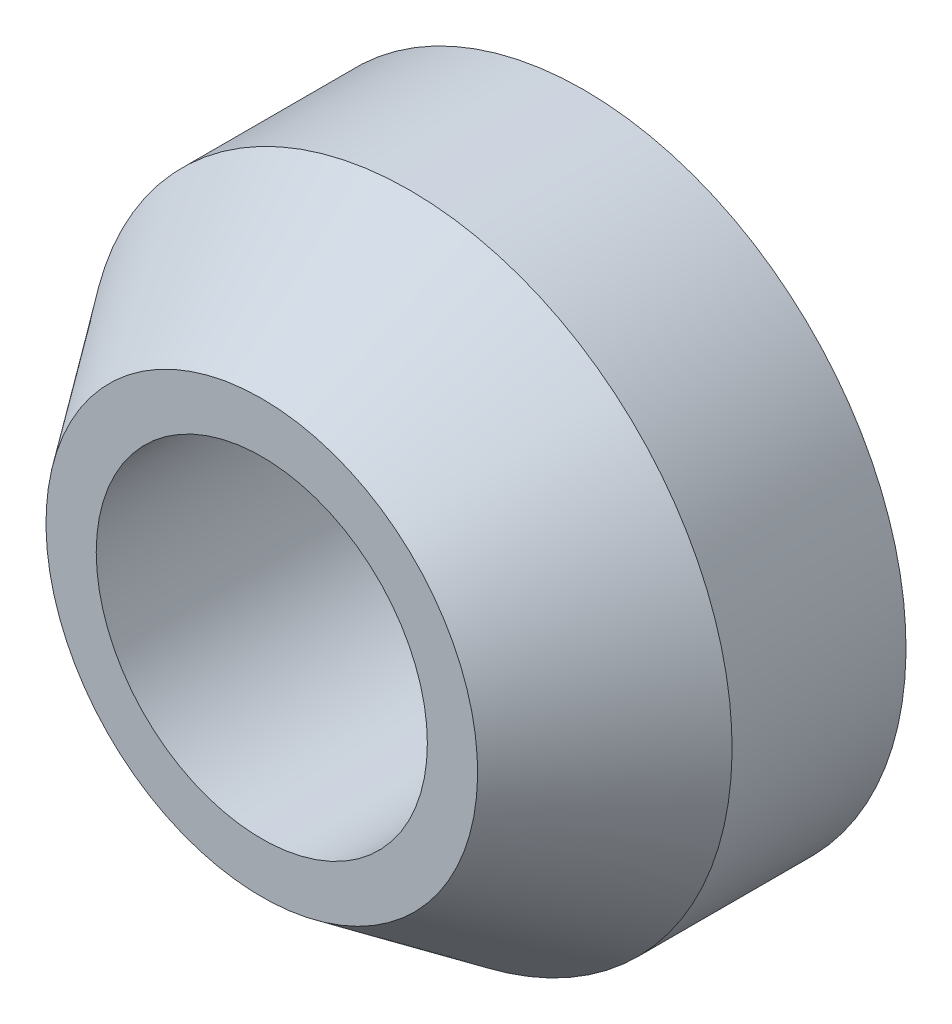
from build123d import *

# Parameters (mm, degrees)
F_1_4_CLEARANCE_HOLE1_D = 6.5278


with BuildPart() as part:
    # Sketch1 → Revolve1 (revolve)
    with BuildSketch(Plane(origin=(0, 0, 0), x_dir=(0, 0, -1), z_dir=(1, 0, 0))):
        Polygon((-6.35, 0), (-6.35, 4.2545), (-3.429, 6.35), (0, 6.35), (0, 0), align=None)
    revolve(axis=Axis((0, 0, 0), (0, 0, 1)))

    # 1/4 Clearance Hole1 (through all)
    with Locations(Plane.XY.offset(6.35)):
        with Locations((0, 0)):
            Hole(F_1_4_CLEARANCE_HOLE1_D / 2)


solid = part.part
